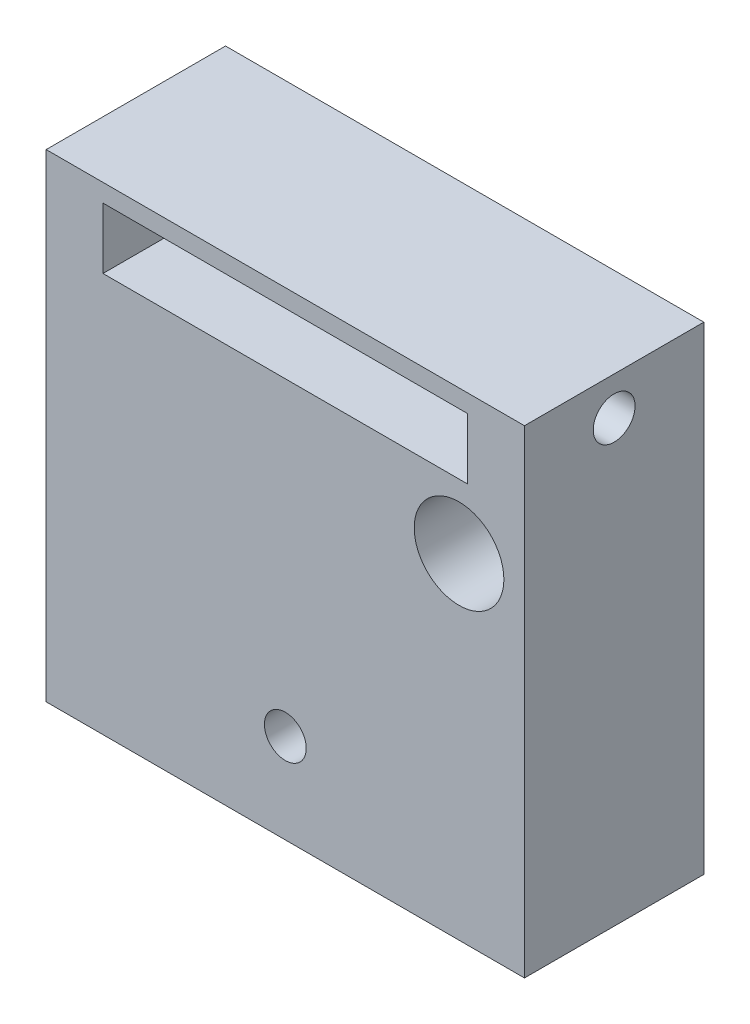
from build123d import *

# Parameters (mm, degrees)
SKETCH1_W           = 80
SKETCH1_H           = 80
BOSS_EXTRUDE1_DEPTH = 30
SKETCH2_W           = 61
SKETCH2_H           = 10.2
CUT_EXTRUDE1_DEPTH  = 65.031242374
SKETCH3_W           = 40
SKETCH3_H           = 25
CUT_EXTRUDE2_DEPTH  = 20
SKETCH4_R           = 3.5
CUT_EXTRUDE3_DEPTH  = 61
SKETCH5_R           = 3.5
CUT_EXTRUDE4_DEPTH  = 95.339811321
SKETCH6_R           = 7.5
CUT_EXTRUDE5_DEPTH  = 65.031242374


with BuildPart() as part:
    # Sketch1 → Boss-Extrude1 (new body)
    with BuildSketch(Plane.XY):
        Rectangle(SKETCH1_W, SKETCH1_H)
    extrude(amount=BOSS_EXTRUDE1_DEPTH)

    # Sketch2 → Cut-Extrude1 (cut, through all)
    with BuildSketch(Plane.XY.offset(30)):
        with Locations((0, 31.9)):
            Rectangle(SKETCH2_W, SKETCH2_H)
    extrude(amount=-CUT_EXTRUDE1_DEPTH, mode=Mode.SUBTRACT)

    # Sketch3 → Cut-Extrude2 (cut)
    with BuildSketch(Plane(origin=(0, 0, 0), x_dir=(-1, 0, 0), z_dir=(0, 0, -1))):
        with Locations((0, -27.5)):
            Rectangle(SKETCH3_W, SKETCH3_H)
    extrude(amount=-CUT_EXTRUDE2_DEPTH, mode=Mode.SUBTRACT)

    # Sketch4 → Cut-Extrude3 (cut, through all)
    with BuildSketch(Plane(origin=(0, 0, 20), x_dir=(-1, 0, 0), z_dir=(0, 0, -1))):
        with Locations((0, -25)):
            Circle(SKETCH4_R)
    extrude(amount=-CUT_EXTRUDE3_DEPTH, mode=Mode.SUBTRACT)

    # Sketch5 → Cut-Extrude4 (cut, through all)
    with BuildSketch(Plane(origin=(40, 0, 0), x_dir=(0, 0, -1), z_dir=(1, 0, 0))):
        with Locations((-15, 33.619017373)):
            Circle(SKETCH5_R)
    extrude(amount=-CUT_EXTRUDE4_DEPTH, mode=Mode.SUBTRACT)

    # Sketch6 → Cut-Extrude5 (cut, through all)
    with BuildSketch(Plane.XY.offset(30)):
        with Locations((29.056312598, 16)):
            Circle(SKETCH6_R)
    extrude(amount=-CUT_EXTRUDE5_DEPTH, mode=Mode.SUBTRACT)


solid = part.part
